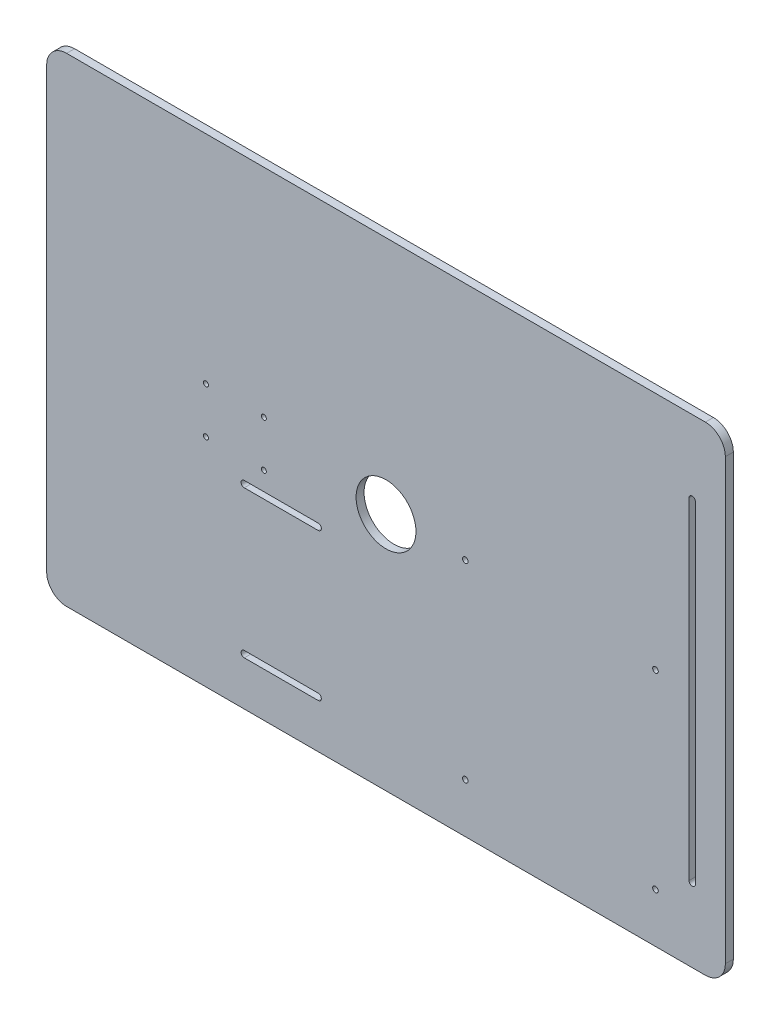
from build123d import *

# Parameters (mm, degrees)
EXTRUDE_1_DEPTH             = 4
SKETCH_1_4_R                = 1.25
CUT_EXTRUDE_4_DEPTH         = 10
PATTERN_LINEAR_1_COUNT      = 2
PATTERN_LINEAR_1_PITCH      = 29
PATTERN_LINEAR_1_COUNT_DIR2 = 2
PATTERN_LINEAR_1_PITCH_DIR2 = 23
CUT_EXTRUDE_6_DEPTH         = 19
SKETCH_1_7_R                = 1.4
CUT_EXTRUDE_8_DEPTH         = 9
CUT_EXTRUDE_10_DEPTH        = 9
SKETCH_1_8_R                = 15
CUT_EXTRUDE_12_DEPTH        = 9


with BuildPart() as part:
    # 草图1 → 凸台-拉伸1 (new body)
    with BuildSketch(Plane.XY):
        with BuildLine():
            Line((160, -120), (-160, -120))
            ThreePointArc((-160, -120), (-167.071067812, -117.071067812), (-170, -110))
            Line((-170, -110), (-170, 110))
            ThreePointArc((-170, 110), (-167.071067812, 117.071067812), (-160, 120))
            Line((-160, 120), (160, 120))
            ThreePointArc((160, 120), (167.071067812, 117.071067812), (170, 110))
            Line((170, 110), (170, -110))
            ThreePointArc((170, -110), (167.071067812, -117.071067812), (160, -120))
        make_face()
    extrude(amount=EXTRUDE_1_DEPTH)

    # 草图1<4> → 切除-拉伸4 (cut)
    with BuildSketch(Plane.XY):
        with Locations((-90.205317251, 11.5)):
            Circle(SKETCH_1_4_R)
    cut_extrude_4 = extrude(amount=CUT_EXTRUDE_4_DEPTH, mode=Mode.SUBTRACT)

    # 阵列(线性)1: Cut-Extrude 4 2 × 2
    with Locations(*[(i * PATTERN_LINEAR_1_PITCH, -j * PATTERN_LINEAR_1_PITCH_DIR2, 0) for i in range(PATTERN_LINEAR_1_COUNT) for j in range(PATTERN_LINEAR_1_COUNT_DIR2) if (i, j) != (0, 0)]):
        add(cut_extrude_4, mode=Mode.SUBTRACT)

    # 草图1<6> → 切除-拉伸6 (cut)
    with BuildSketch(Plane.XY):
        with BuildLine():
            Line((151.8, -83), (151.8, 83))
            ThreePointArc((151.8, 83), (153.4, 84.600001349), (155, 83))
            Line((155, 83), (155, -83))
            ThreePointArc((155, -83), (153.4, -84.600001349), (151.8, -83))
        make_face()
    extrude(amount=CUT_EXTRUDE_6_DEPTH, mode=Mode.SUBTRACT)

    # 草图1<7> → 切除-拉伸8 (cut)
    with BuildSketch(Plane.XY):
        with Locations((135, -95.25)):
            Circle(SKETCH_1_7_R)
        with Locations((39.75, -95.25)):
            Circle(SKETCH_1_7_R)
        with Locations((135, 0)):
            Circle(SKETCH_1_7_R)
        with Locations((39.75, 0)):
            Circle(SKETCH_1_7_R)
    extrude(amount=CUT_EXTRUDE_8_DEPTH, mode=Mode.SUBTRACT)

    # 草图3 → 切除-拉伸10 (cut)
    with BuildSketch(Plane.XY):
        with BuildLine():
            Line((-34, -24), (-71, -24))
            ThreePointArc((-71, -24), (-72.6, -22.4), (-71, -20.8))
            Line((-71, -20.8), (-34, -20.8))
            ThreePointArc((-34, -20.8), (-32.4, -22.4), (-34, -24))
        make_face()
        with BuildLine():
            Line((-34, -94.570317046), (-71, -94.570317046))
            ThreePointArc((-71, -94.570317046), (-72.6, -96.170317046), (-71, -97.770317046))
            Line((-71, -97.770317046), (-34, -97.770317046))
            ThreePointArc((-34, -97.770317046), (-32.4, -96.170317046), (-34, -94.570317046))
        make_face()
    extrude(amount=CUT_EXTRUDE_10_DEPTH, mode=Mode.SUBTRACT)

    # 草图1<8> → 切除-拉伸12 (cut)
    with BuildSketch(Plane.XY):
        Circle(SKETCH_1_8_R)
    extrude(amount=CUT_EXTRUDE_12_DEPTH, mode=Mode.SUBTRACT)


solid = part.part
